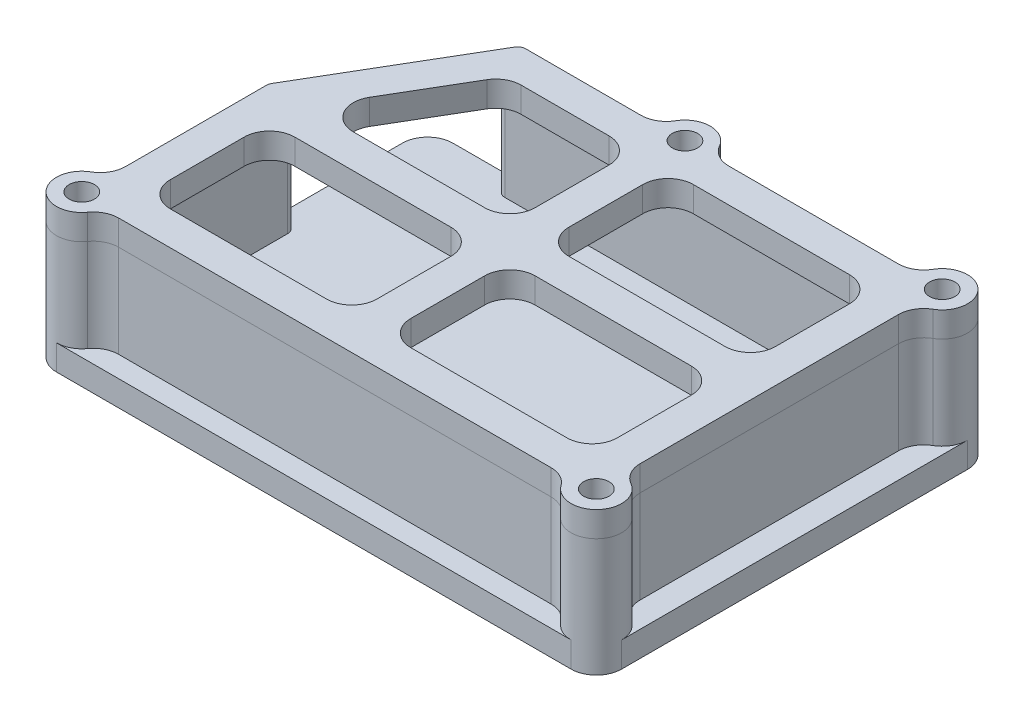
from build123d import *

# Parameters (mm, degrees)
SKETCH5_R           = 1.5
BOSS_EXTRUDE2_DEPTH = 3
SKETCH6_R           = 1.5
BOSS_EXTRUDE3_DEPTH = 11
SKETCH7_R           = 1.5
BOSS_EXTRUDE4_DEPTH = 3


with BuildPart() as part:
    # Sketch5 → Boss-Extrude2 (new body)
    with BuildSketch(Plane(origin=(0, 0, 0), x_dir=(1, 0, 0), z_dir=(0, 1, 0))):
        with BuildLine():
            Line((-5.196152423, 20.5), (-27.5, 20.5))
            ThreePointArc((-27.5, 20.5), (-29.621320344, 19.621320344), (-30.5, 17.5))
            Line((-30.5, 17.5), (-30.5, -15.303847577))
            ThreePointArc((-30.5, -15.303847577), (-30.901923789, -16.803847577), (-32, -17.901923789))
            ThreePointArc((-32, -17.901923789), (-33.397777479, -21.276457135), (-30.5, -23.5))
            Line((-30.5, -23.5), (30.5, -23.5))
            ThreePointArc((30.5, -23.5), (32.621320344, -22.621320344), (33.5, -20.5))
            Line((33.5, -20.5), (33.5, 20.5))
            ThreePointArc((33.5, 20.5), (32.621320344, 22.621320344), (30.5, 23.5))
            Line((30.5, 23.5), (0, 23.5))
            ThreePointArc((0, 23.5), (-1.5, 23.098076211), (-2.598076211, 22))
            ThreePointArc((-2.598076211, 22), (-3.696152423, 20.901923789), (-5.196152423, 20.5))
        make_face()
        with Locations(Location((0, 20.5, 0), (0, 0, 270))):
            Circle(SKETCH5_R, mode=Mode.SUBTRACT)
        with Locations(Location((30.5, 20.5, 0), (0, 0, 270))):
            Circle(SKETCH5_R, mode=Mode.SUBTRACT)
        with Locations(Location((30.5, -20.5, 0), (0, 0, 270))):
            Circle(SKETCH5_R, mode=Mode.SUBTRACT)
        with Locations(Location((-30.5, -20.5, 0), (0, 0, 270))):
            Circle(SKETCH5_R, mode=Mode.SUBTRACT)
    extrude(amount=BOSS_EXTRUDE2_DEPTH)

    # Sketch6 → Boss-Extrude3 (add)
    with BuildSketch(Plane(origin=(0, 3, 0), x_dir=(1, 0, 0), z_dir=(0, 1, 0))):
        with BuildLine():
            Line((-30.5, 1.389438463), (-30.5, -15.303847577))
            ThreePointArc((-30.5, -15.303847577), (-30.901923789, -16.803847577), (-32, -17.901923789))
            ThreePointArc((-32, -17.901923789), (-32.723913835, -22.513506209), (-28.063301414, -22.25))
            ThreePointArc((-28.063301414, -22.25), (-26.995909221, -21.330730437), (-25.626602828, -21))
            Line((-25.626602828, -21), (25.626602828, -21))
            ThreePointArc((25.626602828, -21), (26.995909221, -21.330730437), (28.063301414, -22.25))
            ThreePointArc((28.063301414, -22.25), (32.723913835, -22.513506209), (32, -17.901923789))
            ThreePointArc((32, -17.901923789), (30.901923789, -16.803847577), (30.5, -15.303847577))
            Line((30.5, -15.303847577), (30.5, 15.303847577))
            ThreePointArc((30.5, 15.303847577), (30.901923789, 16.803847577), (32, 17.901923789))
            ThreePointArc((32, 17.901923789), (32.621320344, 22.621320344), (27.901923789, 22))
            ThreePointArc((27.901923789, 22), (26.803847577, 20.901923789), (25.303847577, 20.5))
            Line((25.303847577, 20.5), (5.196152423, 20.5))
            ThreePointArc((5.196152423, 20.5), (3.696152423, 20.901923789), (2.598076211, 22))
            ThreePointArc((2.598076211, 22), (0, 23.5), (-2.598076211, 22))
            ThreePointArc((-2.598076211, 22), (-3.696152423, 20.901923789), (-5.196152423, 20.5))
            Line((-5.196152423, 20.5), (-18.854157071, 20.5))
            ThreePointArc((-18.854157071, 20.5), (-19.561263852, 20.207106781), (-19.854157071, 19.5))
            Line((-19.854157071, 19.5), (-19.854157071, 19))
            ThreePointArc((-19.854157071, 19), (-19.561263852, 18.292893219), (-18.854157071, 18))
            Line((-18.854157071, 18), (26, 18))
            ThreePointArc((26, 18), (27.414213562, 17.414213562), (28, 16))
            Line((28, 16), (28, -16))
            ThreePointArc((28, -16), (27.414213562, -17.414213562), (26, -18))
            Line((26, -18), (-26, -18))
            ThreePointArc((-26, -18), (-27.414213562, -17.414213562), (-28, -16))
            Line((-28, -16), (-28, 1.389438463))
            ThreePointArc((-28, 1.389438463), (-28.292893219, 2.096545244), (-29, 2.389438463))
            Line((-29, 2.389438463), (-29.5, 2.389438463))
            ThreePointArc((-29.5, 2.389438463), (-30.207106781, 2.096545244), (-30.5, 1.389438463))
        make_face()
        with Locations(Location((0, 20.5, 0), (0, 0, 270))):
            Circle(SKETCH6_R, mode=Mode.SUBTRACT)
        with Locations(Location((30.5, 20.5, 0), (0, 0, 270))):
            Circle(SKETCH6_R, mode=Mode.SUBTRACT)
        with Locations(Location((30.5, -20.5, 0), (0, 0, 270))):
            Circle(SKETCH6_R, mode=Mode.SUBTRACT)
        with Locations(Location((-30.5, -20.5, 0), (0, 0, 270))):
            Circle(SKETCH6_R, mode=Mode.SUBTRACT)
    extrude(amount=BOSS_EXTRUDE3_DEPTH)


with BuildPart() as body_2:
    # Sketch7 → Boss-Extrude4 (new body)
    with BuildSketch(Plane(origin=(0, 14, 0), x_dir=(1, 0, 0), z_dir=(0, 1, 0))):
        with BuildLine():
            Line((-30.362088709, 1.896195858), (-19.71624578, 20.006757395))
            ThreePointArc((-19.71624578, 20.006757395), (-19.35076688, 20.367973904), (-18.854157071, 20.5))
            Line((-18.854157071, 20.5), (-5.196152423, 20.5))
            ThreePointArc((-5.196152423, 20.5), (-3.696152423, 20.901923789), (-2.598076211, 22))
            ThreePointArc((-2.598076211, 22), (0, 23.5), (2.598076211, 22))
            ThreePointArc((2.598076211, 22), (3.696152423, 20.901923789), (5.196152423, 20.5))
            Line((5.196152423, 20.5), (25.303847577, 20.5))
            ThreePointArc((25.303847577, 20.5), (26.803847577, 20.901923789), (27.901923789, 22))
            ThreePointArc((27.901923789, 22), (32.621320344, 22.621320344), (32, 17.901923789))
            ThreePointArc((32, 17.901923789), (30.901923789, 16.803847577), (30.5, 15.303847577))
            Line((30.5, 15.303847577), (30.5, -15.303847577))
            ThreePointArc((30.5, -15.303847577), (30.901923789, -16.803847577), (32, -17.901923789))
            ThreePointArc((32, -17.901923789), (32.723913835, -22.513506209), (28.063301414, -22.25))
            ThreePointArc((28.063301414, -22.25), (26.995909221, -21.330730437), (25.626602828, -21))
            Line((25.626602828, -21), (-25.626602828, -21))
            ThreePointArc((-25.626602828, -21), (-26.995909221, -21.330730437), (-28.063301414, -22.25))
            ThreePointArc((-28.063301414, -22.25), (-32.723913835, -22.513506209), (-32, -17.901923789))
            ThreePointArc((-32, -17.901923789), (-30.901923789, -16.803847577), (-30.5, -15.303847577))
            Line((-30.5, -15.303847577), (-30.5, 1.389438463))
            ThreePointArc((-30.5, 1.389438463), (-30.464906397, 1.652032532), (-30.362088709, 1.896195858))
        make_face()
        with Locations(Location((0, 20.5, 0), (0, 0, 270))):
            Circle(SKETCH7_R, mode=Mode.SUBTRACT)
        with Locations(Location((30.5, 20.5, 0), (0, 0, 270))):
            Circle(SKETCH7_R, mode=Mode.SUBTRACT)
        with Locations(Location((30.5, -20.5, 0), (0, 0, 270))):
            Circle(SKETCH7_R, mode=Mode.SUBTRACT)
        with Locations(Location((-30.5, -20.5, 0), (0, 0, 270))):
            Circle(SKETCH7_R, mode=Mode.SUBTRACT)
        with BuildLine():
            Line((-26.5, -14), (-26.5, -5.25))
            ThreePointArc((-26.5, -5.25), (-25.621320344, -3.128679656), (-23.5, -2.25))
            Line((-23.5, -2.25), (-5, -2.25))
            ThreePointArc((-5, -2.25), (-2.878679656, -3.128679656), (-2, -5.25))
            Line((-2, -5.25), (-2, -14))
            ThreePointArc((-2, -14), (-2.878679656, -16.121320344), (-5, -17))
            Line((-5, -17), (-23.5, -17))
            ThreePointArc((-23.5, -17), (-25.621320344, -16.121320344), (-26.5, -14))
        make_face(mode=Mode.SUBTRACT)
        with BuildLine():
            Line((-23.151003052, 6.270272185), (-18.007533291, 15.020272185))
            ThreePointArc((-18.007533291, 15.020272185), (-16.91109659, 16.103921711), (-15.421267163, 16.5))
            Line((-15.421267163, 16.5), (-5, 16.5))
            ThreePointArc((-5, 16.5), (-2.878679656, 15.621320344), (-2, 13.5))
            Line((-2, 13.5), (-2, 4.75))
            ThreePointArc((-2, 4.75), (-2.878679656, 2.628679656), (-5, 1.75))
            Line((-5, 1.75), (-20.564736925, 1.75))
            ThreePointArc((-20.564736925, 1.75), (-23.168658636, 3.260170573), (-23.151003052, 6.270272185))
        make_face(mode=Mode.SUBTRACT)
        with BuildLine():
            Line((26.5, 13.5), (26.5, 4.75))
            ThreePointArc((26.5, 4.75), (25.621320344, 2.628679656), (23.5, 1.75))
            Line((23.5, 1.75), (5, 1.75))
            ThreePointArc((5, 1.75), (2.878679656, 2.628679656), (2, 4.75))
            Line((2, 4.75), (2, 13.5))
            ThreePointArc((2, 13.5), (2.878679656, 15.621320344), (5, 16.5))
            Line((5, 16.5), (23.5, 16.5))
            ThreePointArc((23.5, 16.5), (25.621320344, 15.621320344), (26.5, 13.5))
        make_face(mode=Mode.SUBTRACT)
        with BuildLine():
            Line((23.5, -17), (5, -17))
            ThreePointArc((5, -17), (2.878679656, -16.121320344), (2, -14))
            Line((2, -14), (2, -5.25))
            ThreePointArc((2, -5.25), (2.878679656, -3.128679656), (5, -2.25))
            Line((5, -2.25), (23.5, -2.25))
            ThreePointArc((23.5, -2.25), (25.621320344, -3.128679656), (26.5, -5.25))
            Line((26.5, -5.25), (26.5, -14))
            ThreePointArc((26.5, -14), (25.621320344, -16.121320344), (23.5, -17))
        make_face(mode=Mode.SUBTRACT)
    extrude(amount=BOSS_EXTRUDE4_DEPTH)


solid = Compound([part.part, body_2.part])
